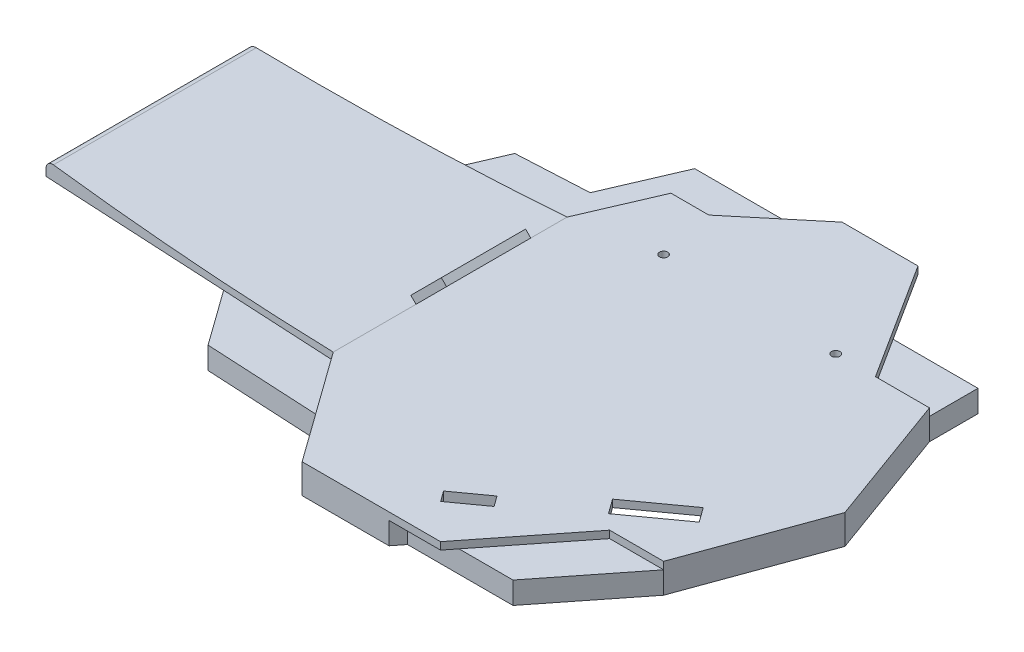
from build123d import *

# Parameters (mm, degrees)
EXTRUDE_1_DEPTH          = 2
EXTRUDE_2_DEPTH          = 2
CUT_EXTRUDE_3_DEPTH      = 202.869395429
CUT_EXTRUDE_3_DEPTH_BACK = 202.869395429
FILLET_1_R               = 2
EXTRUDE_4_DEPTH          = 6
HOLE_WIZARD_4_40_2_D     = 2.2606
CUT_EXTRUDE_7_DEPTH      = 202.98824919
EXTRUDE_5_DEPTH          = 2


with BuildPart() as part:
    # 草图2 → 凸台-拉伸1 (new body)
    with BuildSketch(Plane(origin=(0, 0, 0), x_dir=(1, 0, 0), z_dir=(0, 1, 0))):
        Polygon((141.821582241, 68.082690978), (121.161879345, 68.082690978), (101.35099463, 51.608897425), (91.039832206, 51.608897425), (82.527346571, 31.825074964), (0, 27.5), (0, -27.5), (82.527346571, -31.825074964), (104.14664553, -61.917309022), (141.821582241, -61.917309022), (162.133732132, -36.18552755), (176.829545061, -36.18552755), (190, 0), (176.829545061, 36.18552755), (162.133732132, 36.18552755), align=None)
    extrude(amount=EXTRUDE_1_DEPTH)

    # 草图6 → 凸台-拉伸2 (add)
    with BuildSketch(Plane(origin=(0, 2, 0), x_dir=(1, 0, 0), z_dir=(0, 1, 0))):
        Polygon((82.527346571, 31.825074964), (82.527346571, -31.825074964), (0, -27.5), (0, 27.5), align=None)
    extrude(amount=EXTRUDE_2_DEPTH)

    # 草图7 → 切除-拉伸3 (cut, two sides: drawn at the far end of the back side and taken through both)
    with BuildSketch(Plane.XY.offset(-CUT_EXTRUDE_3_DEPTH_BACK)):
        with BuildLine():
            Line((82.527346571, 2), (82.527346571, 30.740821148))
            Line((82.527346571, 30.740821148), (0, 4))
            add(Edge.make_bspline(
                [(82.527346571, 2), (41.215261335, 1.001172546), (0, 4)],
                knots=[0, 0, 0, 1, 1, 1], degree=2))
        make_face()
    extrude(amount=CUT_EXTRUDE_3_DEPTH + CUT_EXTRUDE_3_DEPTH_BACK, mode=Mode.SUBTRACT)

    # 圆角1
    fillet_1_edges = [part.edges().sort_by_distance(p)[0] for p in [
        (0, 4, 13.75),
    ]]
    fillet(fillet_1_edges, radius=FILLET_1_R)

    # 草图13 → 凸台-拉伸4 (add)
    with BuildSketch(Plane.XZ):
        Polygon((53.501507434, -30.303895193), (58.412275987, -41.716986195), (77.926898746, -42.739704237), (86.484415452, -62.62818317), (136.164724768, -62.62818317), (144.584081331, -49.40685536), (176.829545061, -49.40685536), (176.829545061, -36.18552755), (190, 0), (176.829545061, 36.18552755), (158.743204348, 59.097615602), (130.016377906, 59.097615602), (127.790568727, 61.917309022), (104.14664553, 61.917309022), (93.336996051, 46.871191993), (61.845926158, 45.220814953), (51.036276678, 30.174697924), (171.852914921, 31.825074964), (171.852914921, -31.825074964), align=None)
    extrude(amount=EXTRUDE_4_DEPTH)

    # #4-40 螺纹孔2 (through all)
    with Locations(Plane(origin=(0, 2, 0), x_dir=(1, 0, 0), z_dir=(0, 1, 0))):
        with Locations((151.351021218, 36.159959894), (104.497931561, 36.159959894)):
            Hole(HOLE_WIZARD_4_40_2_D / 2)

    # 草图18 → 切除-拉伸7 (cut, through all)
    with BuildSketch(Plane(origin=(0, 2, 0), x_dir=(1, 0, 0), z_dir=(0, 1, 0))):
        Polygon((169.563862496, -18.125868021), (155.218286362, -28.471875769), (158.085778721, -32.447885738), (172.431354854, -22.101877989), align=None)
        Polygon((130.302091903, -49.564637909), (132.361562224, -52.420260001), (140.814695434, -46.323873151), (138.755225113, -43.468251059), align=None)
    extrude(amount=-CUT_EXTRUDE_7_DEPTH, mode=Mode.SUBTRACT)


with BuildPart() as body_2:
    # 草图23 → 凸台-拉伸5 (new body)
    with BuildSketch(Plane(origin=(40.263673286, -40.263673286, 0), x_dir=(0, 0, -1), z_dir=(-0.7071067811865488, 0.7071067811865464, 0))):
        Polygon((-9.292036768, -59.769859956), (13.638077716, -59.769859956), (13.638077716, -71.520555916), (-9.292036768, -71.520555916), (-9.292036768, -60.809778756), align=None)
    extrude(amount=EXTRUDE_5_DEPTH)


solid = Compound([part.part, body_2.part])
